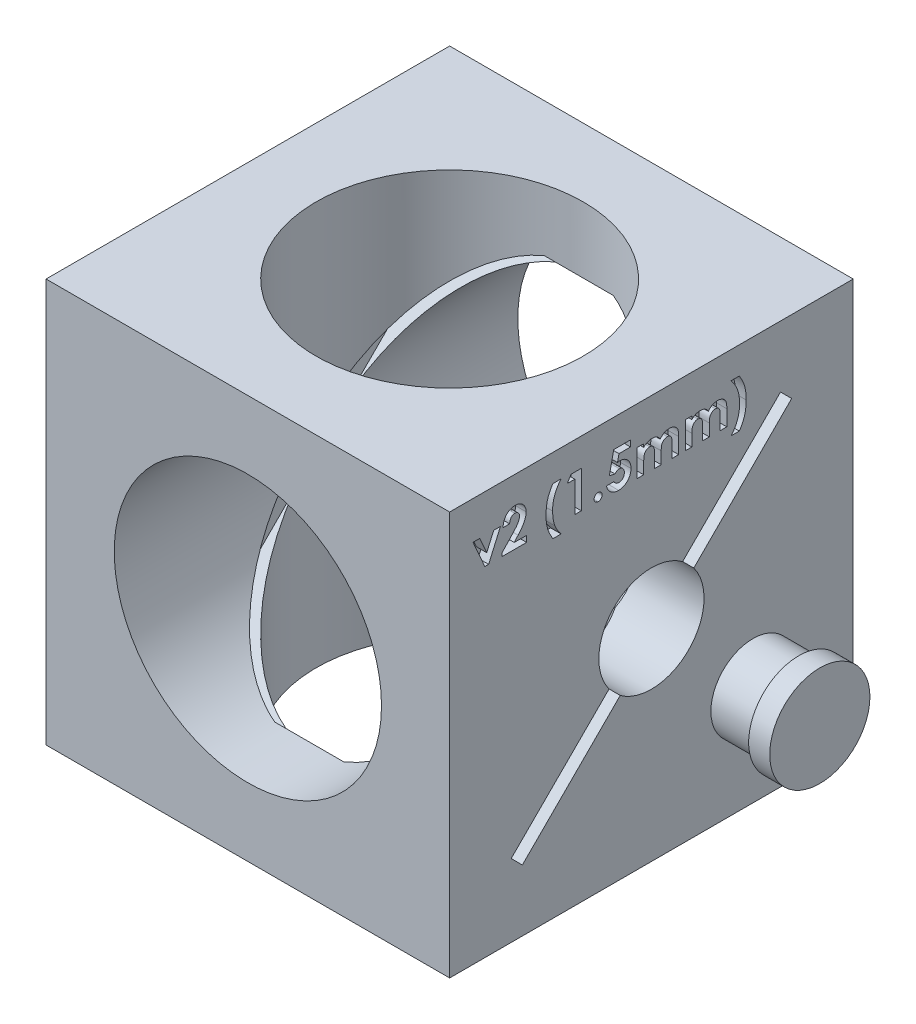
from build123d import *

# Parameters (mm, degrees)
SKETCH1_W               = 38.354
SKETCH1_H               = 38.354
BOSS_EXTRUDE1_DEPTH     = 19.177
CUT_EXTRUDE1_DEPTH      = 34.215538337
CUT_EXTRUDE1_DEPTH_BACK = 34.215538337
SKETCH2_R               = 12.7
CUT_EXTRUDE3_DEPTH      = 47.973864797
CUT_EXTRUDE3_DEPTH_BACK = 47.973864797
SKETCH3_R               = 12.7
CUT_EXTRUDE4_DEPTH      = 12.5
CUT_EXTRUDE5_DEPTH      = 34.215538337
SKETCH5_R               = 5
CUT_EXTRUDE6_DEPTH      = 10
CUT_EXTRUDE7_DEPTH      = 1
SKETCH7_R               = 4
BOSS_EXTRUDE2_DEPTH     = 6.35
SKETCH8_R               = 4.7625
BOSS_EXTRUDE3_DEPTH     = 2


with BuildPart() as part:
    # Sketch1 → Boss-Extrude1 (new, symmetric)
    with BuildSketch(Plane(origin=(0, 0, 0), x_dir=(1, 0, 0), z_dir=(0, 1, 0))):
        Rectangle(SKETCH1_W, SKETCH1_H)
    extrude(amount=BOSS_EXTRUDE1_DEPTH, both=True)

    # Sketch2 → Cut-Extrude1 (cut, two sides: drawn at the far end of the back side and taken through both)
    with BuildSketch(Plane.XY.offset(-CUT_EXTRUDE1_DEPTH_BACK)):
        Circle(SKETCH2_R)
    extrude(amount=CUT_EXTRUDE1_DEPTH + CUT_EXTRUDE1_DEPTH_BACK, mode=Mode.SUBTRACT)

    # Sketch3 → Cut-Extrude3 (cut, two sides: drawn at the far end of the back side and taken through both)
    with BuildSketch(Plane(origin=(0, 19.177, 0), x_dir=(0, 0, -1), z_dir=(0, -1, 0)).offset(-CUT_EXTRUDE3_DEPTH_BACK)):
        Circle(SKETCH3_R)
    extrude(amount=CUT_EXTRUDE3_DEPTH + CUT_EXTRUDE3_DEPTH_BACK, mode=Mode.SUBTRACT)

    # Sketch4 → Cut-Extrude4 (cut, symmetric)
    with BuildSketch(Plane(origin=(0, 0, 0), x_dir=(0, 0, -1), z_dir=(1, 0, 0))):
        Polygon((-12.268302654, -13.328962825), (13.328962825, 12.268302654), (12.268302654, 13.328962825), (-13.328962825, -12.268302654), align=None)
    extrude(amount=CUT_EXTRUDE4_DEPTH, both=True, mode=Mode.SUBTRACT)

    # Sketch4<2> → Cut-Extrude5 (cut, through all)
    with BuildSketch(Plane(origin=(0, 0, 0), x_dir=(0, 0, -1), z_dir=(1, 0, 0))):
        Polygon((-12.268302654, -13.328962825), (13.328962825, 12.268302654), (12.268302654, 13.328962825), (-13.328962825, -12.268302654), align=None)
    extrude(amount=CUT_EXTRUDE5_DEPTH, mode=Mode.SUBTRACT)

    # Sketch5 → Cut-Extrude6 (cut)
    with BuildSketch(Plane(origin=(19.177, 0, 0), x_dir=(0, 0, -1), z_dir=(1, 0, 0))):
        Circle(SKETCH5_R)
    extrude(amount=-CUT_EXTRUDE6_DEPTH, mode=Mode.SUBTRACT)

    # Sketch6 → Cut-Extrude7 (cut)
    with BuildSketch(Plane(origin=(19.177, 0, 0), x_dir=(0, 0, -1), z_dir=(1, 0, 0))):
        Polygon((-16.953526918, 15.574086484), (-16.314103841, 15.574086484), (-15.652244867, 14.064571259), (-14.990385892, 15.574086484), (-14.350962815, 15.574086484), (-15.471355444, 13.016394176), (-15.83313429, 13.016394176), align=None)
        with BuildLine():
            Line((-13.475962815, 15.349727509), (-14.104167944, 15.349727509))
            add(Edge.make_bspline(
                [(-14.104167944, 15.349727509), (-14.101454822, 15.397247904), (-14.096153545, 15.490099901), (-14.075066406, 15.624970401), (-14.046810364, 15.752408193), (-14.009098924, 15.871967484), (-13.961712033, 15.983604832), (-13.905869076, 16.087700814), (-13.840143394, 16.183707362), (-13.765933845, 16.271161479), (-13.684500303, 16.349617375), (-13.597533409, 16.419181301), (-13.503702885, 16.476583701), (-13.404723094, 16.523820563), (-13.300610889, 16.56156062), (-13.190381205, 16.586792903), (-13.07498847, 16.603880451), (-12.995992799, 16.60537568), (-12.955730444, 16.606137766)],
                knots=[0, 0, 0, 0, 1.199038563, 2.342849363, 3.436047546, 4.486744587, 5.497670872, 6.488682221, 7.459191391, 8.424610317, 9.374430501, 10.305433194, 11.225809216, 12.140057399, 13.06607119, 14.010487599, 14.985989317, 16, 16, 16, 16], degree=3))
            add(Edge.make_bspline(
                [(-12.955730444, 16.606137766), (-12.906308974, 16.604595686), (-12.809826684, 16.601585184), (-12.669630263, 16.575904604), (-12.538702135, 16.532949867), (-12.417137471, 16.47293077), (-12.305971174, 16.396682799), (-12.205221677, 16.305769572), (-12.117935806, 16.198283683), (-12.043560143, 16.078697443), (-11.981762857, 15.952072446), (-11.938457892, 15.821136948), (-11.909994005, 15.689365446), (-11.906958155, 15.600637187), (-11.905449995, 15.556558439)],
                knots=[0, 0, 0, 0, 1.075374347, 2.099382735, 3.09057751, 4.06680945, 5.040638231, 6.016817125, 7.011024321, 8.044445721, 9.0776792, 10.070479129, 11.0414456, 12, 12, 12, 12], degree=3))
            add(Edge.make_bspline(
                [(-11.905449995, 15.556558439), (-11.906037193, 15.529896497), (-11.907219078, 15.476232594), (-11.915436878, 15.395025937), (-11.927765203, 15.312307463), (-11.946353313, 15.228148095), (-11.96953421, 15.142524241), (-11.997655988, 15.05517966), (-12.03137096, 14.966609562), (-12.070116491, 14.875817107), (-12.116340008, 14.782507527), (-12.170160869, 14.685282075), (-12.233007601, 14.584226997), (-12.304121094, 14.478771705), (-12.383846731, 14.369082516), (-12.472573705, 14.255489849), (-12.569280089, 14.137593441), (-12.637915331, 14.058786308), (-12.67317836, 14.018297221)],
                knots=[0, 0, 0, 0, 0.728284026, 1.46585585, 2.227944881, 3.01186502, 3.81876927, 4.650621989, 5.517437689, 6.406905708, 7.346299482, 8.360816762, 9.441613733, 10.596154504, 11.834900912, 13.145207542, 14.533280747, 16, 16, 16, 16], degree=3))
            Line((-12.67317836, 14.018297221), (-13.038462815, 13.599727509))
            Line((-13.038462815, 13.599727509), (-11.8605782, 13.599727509))
            Line((-11.8605782, 13.599727509), (-11.8605782, 13.016394176))
            Line((-11.8605782, 13.016394176), (-14.193911533, 13.016394176))
            Line((-14.193911533, 13.016394176), (-14.193911533, 13.334703471))
            Line((-14.193911533, 13.334703471), (-13.157653521, 14.437568054))
            add(Edge.make_bspline(
                [(-13.157653521, 14.437568054), (-13.127651188, 14.469738957), (-13.069545568, 14.532044454), (-12.986867258, 14.623546706), (-12.91205069, 14.710380158), (-12.846647249, 14.793469413), (-12.787224643, 14.870119392), (-12.736432524, 14.942640423), (-12.693806183, 15.010376888), (-12.647529244, 15.092055235), (-12.603581364, 15.189471198), (-12.563256525, 15.301698382), (-12.538675744, 15.408961723), (-12.535282819, 15.478856822), (-12.533655123, 15.512387766)],
                knots=[0, 0, 0, 0, 1.246127091, 2.413378631, 3.493388633, 4.492180848, 5.408488754, 6.240484944, 6.999099869, 7.674939598, 8.898438119, 10.020720584, 11.050475521, 12, 12, 12, 12], degree=3))
            add(Edge.make_bspline(
                [(-12.533655123, 15.512387766), (-12.534872112, 15.544826367), (-12.537230224, 15.607681358), (-12.563143957, 15.697092249), (-12.603290411, 15.778044682), (-12.659862435, 15.84811971), (-12.728388875, 15.905705007), (-12.807577612, 15.948535332), (-12.896783027, 15.973248234), (-12.959317723, 15.976341407), (-12.991487655, 15.977932638)],
                knots=[0, 0, 0, 0, 1.062038974, 2.057870785, 3.028805853, 4.01125022, 4.991535629, 5.949134679, 6.94496649, 8, 8, 8, 8], degree=3))
            add(Edge.make_bspline(
                [(-12.991487655, 15.977932638), (-13.008107052, 15.977344818), (-13.040825004, 15.9761876), (-13.088917836, 15.968484315), (-13.134681621, 15.954908079), (-13.178625735, 15.936717834), (-13.220281195, 15.912606534), (-13.259542933, 15.882885514), (-13.296824621, 15.848310055), (-13.33195527, 15.808988268), (-13.363928746, 15.765105143), (-13.392327471, 15.717061461), (-13.415808489, 15.664887046), (-13.436482031, 15.609270678), (-13.452426456, 15.549614993), (-13.464035975, 15.486277024), (-13.472861917, 15.419359812), (-13.474910379, 15.373360522), (-13.475962815, 15.349727509)],
                knots=[0, 0, 0, 0, 0.903469896, 1.778625579, 2.63899355, 3.493148037, 4.358286772, 5.247621495, 6.164656832, 7.118446693, 8.109501108, 9.111810964, 10.146451449, 11.215617525, 12.33435995, 13.498009769, 14.714554818, 16, 16, 16, 16], degree=3))
        make_face()
        with BuildLine():
            Line((-9.369492463, 16.606137766), (-8.584937174, 16.606137766))
            add(Edge.make_bspline(
                [(-8.584937174, 16.606137766), (-8.618302729, 16.567446187), (-8.684552619, 16.490621063), (-8.775970004, 16.370229089), (-8.861947043, 16.248153696), (-8.941254244, 16.123203094), (-9.014041285, 15.99559168), (-9.080909086, 15.865952964), (-9.140567383, 15.733637064), (-9.194056936, 15.598691844), (-9.241277206, 15.459989793), (-9.281902738, 15.316754706), (-9.316128169, 15.168848462), (-9.344272337, 15.016094259), (-9.365889837, 14.858629782), (-9.380960395, 14.696038351), (-9.391447276, 14.528851582), (-9.392232376, 14.415616166), (-9.392629482, 14.358341291)],
                knots=[0, 0, 0, 0, 1.00236213, 1.990267575, 2.964862165, 3.931797803, 4.893137898, 5.846900052, 6.793123604, 7.740135921, 8.694427184, 9.667077551, 10.660503013, 11.672460941, 12.714089686, 13.778281025, 14.87624668, 16, 16, 16, 16], degree=3))
            add(Edge.make_bspline(
                [(-9.392629482, 14.358341291), (-9.391969655, 14.296394575), (-9.390668945, 14.1742797), (-9.379974237, 13.993922463), (-9.362285246, 13.819255753), (-9.339052141, 13.649946068), (-9.307112875, 13.486779984), (-9.269512627, 13.328897075), (-9.224221447, 13.176997753), (-9.188168455, 13.078856122), (-9.170373873, 13.030416612)],
                knots=[0, 0, 0, 0, 1.097990858, 2.164457195, 3.201156713, 4.209415668, 5.192484095, 6.147015238, 7.085427113, 8, 8, 8, 8], degree=3))
            add(Edge.make_bspline(
                [(-9.170373873, 13.030416612), (-9.155112042, 12.99308202), (-9.123946202, 12.916841891), (-9.068506696, 12.803207669), (-9.006451304, 12.687105512), (-8.936135902, 12.569057194), (-8.860528079, 12.44753497), (-8.774766143, 12.325209563), (-8.683382293, 12.199538533), (-8.618156848, 12.116419472), (-8.584937174, 12.074086484)],
                knots=[0, 0, 0, 0, 0.860028042, 1.756243877, 2.695094802, 3.667075869, 4.686284936, 5.746781471, 6.852423585, 8, 8, 8, 8], degree=3))
            Line((-8.584937174, 12.074086484), (-9.369492463, 12.074086484))
            add(Edge.make_bspline(
                [(-9.369492463, 12.074086484), (-9.399069033, 12.122485947), (-9.457127885, 12.217494164), (-9.536681507, 12.361437656), (-9.611514255, 12.501572382), (-9.677878243, 12.640365828), (-9.738880377, 12.775990202), (-9.790705441, 12.910350495), (-9.838626324, 13.041213389), (-9.878097923, 13.171952532), (-9.911817129, 13.304203496), (-9.941649092, 13.440678092), (-9.965698957, 13.58300607), (-9.986287598, 13.730965312), (-10.001384345, 13.884661213), (-10.012497574, 14.043877158), (-10.019864695, 14.208699242), (-10.020507806, 14.320472666), (-10.02083461, 14.37727158)],
                knots=[0, 0, 0, 0, 1.119871376, 2.19830916, 3.246961562, 4.256259542, 5.235550337, 6.182491613, 7.09917337, 7.986748165, 8.877687696, 9.793695483, 10.744317876, 11.727190303, 12.742913882, 13.793068013, 14.878522868, 16, 16, 16, 16], degree=3))
            add(Edge.make_bspline(
                [(-10.02083461, 14.37727158), (-10.020567837, 14.432904328), (-10.020041864, 14.542590459), (-10.01178599, 14.704370757), (-9.999911149, 14.861004379), (-9.984401766, 15.012442368), (-9.962121329, 15.158469068), (-9.936652557, 15.299389656), (-9.905672825, 15.435047069), (-9.869741955, 15.566545011), (-9.827908024, 15.695525622), (-9.780893886, 15.824247262), (-9.727512765, 15.953342095), (-9.66768075, 16.082931533), (-9.602521827, 16.213572394), (-9.531041605, 16.344580813), (-9.453040758, 16.475786442), (-9.397553545, 16.562357109), (-9.369492463, 16.606137766)],
                knots=[0, 0, 0, 0, 1.13127193, 2.230428031, 3.293392423, 4.325815098, 5.325330466, 6.296707414, 7.23754678, 8.15420938, 9.068070667, 9.994306547, 10.940496973, 11.908145907, 12.896524899, 13.908929949, 14.942500703, 16, 16, 16, 16], degree=3))
        make_face()
        Polygon((-7.626503681, 16.516394176), (-6.655449995, 16.516394176), (-6.655449995, 13.016394176), (-7.283655123, 13.016394176), (-7.283655123, 15.933060843), (-8.001603841, 15.933060843), align=None)
        with BuildLine():
            add(Edge.make_bspline(
                [(-5.062501277, 13.734342894), (-5.037141381, 13.732952472), (-4.987212125, 13.730214971), (-4.915071158, 13.709785286), (-4.84996352, 13.673080447), (-4.791748593, 13.625205347), (-4.742523516, 13.567605208), (-4.706944744, 13.501919293), (-4.68478895, 13.430056296), (-4.682342934, 13.379969956), (-4.681091021, 13.354334881)],
                knots=[0, 0, 0, 0, 1.016957001, 2.002212695, 2.9757545, 3.99499976, 5.013036768, 5.994806404, 6.97370641, 8, 8, 8, 8], degree=3))
            add(Edge.make_bspline(
                [(-4.681091021, 13.354334881), (-4.682334733, 13.328695689), (-4.684764725, 13.278601305), (-4.70709806, 13.206598277), (-4.74247035, 13.140372484), (-4.791752542, 13.082155123), (-4.849722432, 13.033377771), (-4.915220852, 12.997011404), (-4.987074698, 12.975422796), (-5.037117192, 12.972835028), (-5.062501277, 12.971522381)],
                knots=[0, 0, 0, 0, 1.023218912, 1.999186227, 2.986238111, 4.008388923, 5.030539734, 6.0011649, 6.986089706, 8, 8, 8, 8], degree=3))
            add(Edge.make_bspline(
                [(-5.062501277, 12.971522381), (-5.087891377, 12.972824354), (-5.137945728, 12.975391079), (-5.209911266, 12.997193375), (-5.275893246, 13.033134975), (-5.333877701, 13.08221429), (-5.383380064, 13.140166332), (-5.417746688, 13.206807232), (-5.440288051, 13.278574159), (-5.442684823, 13.328686499), (-5.443911533, 13.354334881)],
                knots=[0, 0, 0, 0, 1.013427518, 1.99788335, 2.976245624, 3.997909735, 5.019573847, 6.001765691, 6.977268297, 8, 8, 8, 8], degree=3))
            add(Edge.make_bspline(
                [(-5.443911533, 13.354334881), (-5.44267673, 13.379979307), (-5.440264146, 13.430083914), (-5.417899567, 13.501707932), (-5.383324986, 13.567812481), (-5.333881829, 13.625146057), (-5.275650916, 13.673321348), (-5.2100618, 13.709605809), (-5.13780837, 13.730246922), (-5.087867217, 13.732963234), (-5.062501277, 13.734342894)],
                knots=[0, 0, 0, 0, 1.025808215, 2.00424526, 2.981110158, 3.998665696, 5.017428914, 5.998734231, 6.983523959, 8, 8, 8, 8], degree=3))
        make_face()
        with BuildLine():
            Line((-3.582433168, 16.516394176), (-1.988783328, 16.516394176))
            Line((-1.988783328, 16.516394176), (-1.988783328, 15.933060843))
            Line((-1.988783328, 15.933060843), (-3.084636694, 15.933060843))
            Line((-3.084636694, 15.933060843), (-3.221355444, 15.271201868))
            add(Edge.make_bspline(
                [(-3.221355444, 15.271201868), (-3.202725557, 15.276390527), (-3.165983592, 15.286623628), (-3.110631777, 15.296886133), (-3.056988155, 15.303537963), (-3.021787537, 15.304425229), (-3.004708809, 15.304855714)],
                knots=[0, 0, 0, 0, 1.05461699, 2.079921384, 3.068411212, 4, 4, 4, 4], degree=3))
            add(Edge.make_bspline(
                [(-3.004708809, 15.304855714), (-2.967492471, 15.304002924), (-2.894130871, 15.302321885), (-2.786812159, 15.286363346), (-2.684048152, 15.26122913), (-2.586153321, 15.225382554), (-2.493223294, 15.178727308), (-2.405145422, 15.122287539), (-2.321811605, 15.055964118), (-2.244702202, 14.979715521), (-2.173850861, 14.895992835), (-2.112249661, 14.805437892), (-2.059638392, 14.709341916), (-2.017793208, 14.607107577), (-1.984765421, 14.499376976), (-1.960898805, 14.386081076), (-1.946785282, 14.267085603), (-1.94488216, 14.1859035), (-1.943911533, 14.144499144)],
                knots=[0, 0, 0, 0, 1.01440847, 1.999622559, 2.951875003, 3.895578053, 4.836219714, 5.782137149, 6.743708247, 7.735272588, 8.734977101, 9.730283169, 10.717124674, 11.717316708, 12.737475749, 13.78628267, 14.87096371, 16, 16, 16, 16], degree=3))
            add(Edge.make_bspline(
                [(-1.943911533, 14.144499144), (-1.945097655, 14.102624753), (-1.94743822, 14.019994338), (-1.962708262, 13.8984984), (-1.98966016, 13.78213272), (-2.026681289, 13.670585789), (-2.075454256, 13.56467745), (-2.134110424, 13.463310573), (-2.203641511, 13.367237571), (-2.283365179, 13.277443309), (-2.370035263, 13.195369629), (-2.462318444, 13.123169257), (-2.559566403, 13.062413228), (-2.661781489, 13.013312085), (-2.768377259, 12.974464134), (-2.879386068, 12.946184681), (-2.995347404, 12.929967986), (-3.074070084, 12.927768538), (-3.114083809, 12.926650586)],
                knots=[0, 0, 0, 0, 1.06808661, 2.107647099, 3.116961351, 4.110378221, 5.100014249, 6.085620622, 7.093190682, 8.119403071, 9.144090782, 10.133780668, 11.103064255, 12.062861538, 13.020824475, 13.992378307, 14.979551724, 16, 16, 16, 16], degree=3))
            add(Edge.make_bspline(
                [(-3.114083809, 12.926650586), (-3.149866893, 12.92756514), (-3.220438622, 12.929368831), (-3.324387681, 12.940455269), (-3.424606117, 12.960056194), (-3.520561879, 12.988423808), (-3.613264584, 13.023337865), (-3.701642561, 13.067004492), (-3.786181462, 13.118592216), (-3.866641228, 13.177159562), (-3.941714504, 13.243133404), (-4.010233435, 13.315353143), (-4.072612844, 13.392908481), (-4.127517909, 13.476756218), (-4.174776519, 13.566772471), (-4.216686419, 13.66189638), (-4.250990092, 13.763121342), (-4.268398218, 13.833296109), (-4.277244867, 13.868958279)],
                knots=[0, 0, 0, 0, 1.054957082, 2.080596141, 3.077793124, 4.061112343, 5.027190972, 5.994718051, 6.962465889, 7.943658696, 8.924948258, 9.904494768, 10.875059, 11.855380583, 12.854004648, 13.869083016, 14.917087635, 16, 16, 16, 16], degree=3))
            Line((-4.277244867, 13.868958279), (-3.559296149, 13.868958279))
            add(Edge.make_bspline(
                [(-3.559296149, 13.868958279), (-3.546172029, 13.844245847), (-3.5206668, 13.796220057), (-3.472150215, 13.732458604), (-3.417838978, 13.678085577), (-3.358223007, 13.632569738), (-3.292916026, 13.598470046), (-3.224579173, 13.572610418), (-3.152353959, 13.557667096), (-3.103165399, 13.555799033), (-3.078326598, 13.554855714)],
                knots=[0, 0, 0, 0, 1.104910296, 2.147267069, 3.153527244, 4.136738762, 5.099945312, 6.05603338, 7.018353, 8, 8, 8, 8], degree=3))
            add(Edge.make_bspline(
                [(-3.078326598, 13.554855714), (-3.061014286, 13.555507084), (-3.026952021, 13.556788664), (-2.97676666, 13.563568545), (-2.928862527, 13.576409485), (-2.882883469, 13.594191202), (-2.838705972, 13.616367011), (-2.796963336, 13.644362526), (-2.756929316, 13.676586401), (-2.719213391, 13.713563407), (-2.685053634, 13.754784168), (-2.655099263, 13.799078685), (-2.628315925, 13.845462725), (-2.608477097, 13.895773677), (-2.592230775, 13.948509237), (-2.580266326, 14.004067206), (-2.573116218, 14.06251247), (-2.57245431, 14.102411414), (-2.572116662, 14.122764368)],
                knots=[0, 0, 0, 0, 0.978869489, 1.925942215, 2.855067702, 3.774946051, 4.70828698, 5.642468714, 6.60995405, 7.609372294, 8.622401667, 9.629904756, 10.629323, 11.642352373, 12.678539694, 13.745912462, 14.850161547, 16, 16, 16, 16], degree=3))
            add(Edge.make_bspline(
                [(-2.572116662, 14.122764368), (-2.572508541, 14.142644884), (-2.573271344, 14.181342791), (-2.579581403, 14.238165179), (-2.590869977, 14.292079342), (-2.606250755, 14.343498222), (-2.625939988, 14.392109578), (-2.650001546, 14.43820277), (-2.678538224, 14.481544812), (-2.711703228, 14.521253303), (-2.747070047, 14.55767506), (-2.785065376, 14.589529239), (-2.825346895, 14.615965996), (-2.866662907, 14.639046054), (-2.910662599, 14.655843217), (-2.956356593, 14.667410803), (-3.003696837, 14.675898633), (-3.03598659, 14.676397324), (-3.052385091, 14.676650586)],
                knots=[0, 0, 0, 0, 1.166249705, 2.270133367, 3.348514167, 4.393962215, 5.415026464, 6.420877785, 7.440098956, 8.453121383, 9.451844239, 10.415694839, 11.355045125, 12.27538808, 13.187007209, 14.108269027, 15.039275622, 16, 16, 16, 16], degree=3))
            add(Edge.make_bspline(
                [(-3.052385091, 14.676650586), (-3.070197675, 14.675974698), (-3.105897914, 14.674620072), (-3.158939534, 14.663597844), (-3.211341619, 14.645759745), (-3.26339558, 14.62114926), (-3.31458469, 14.5889419), (-3.366259855, 14.55116636), (-3.416691396, 14.505077888), (-3.448757172, 14.470751089), (-3.465345828, 14.452992734)],
                knots=[0, 0, 0, 0, 0.88288272, 1.769486374, 2.674910571, 3.623812639, 4.617874466, 5.670434592, 6.794841017, 8, 8, 8, 8], degree=3))
            Line((-3.465345828, 14.452992734), (-3.993991662, 14.574286804))
            Line((-3.993991662, 14.574286804), (-3.582433168, 16.516394176))
        make_face()
        with BuildLine():
            Line((-1.3605782, 15.574086484), (-0.732373072, 15.574086484))
            Line((-0.732373072, 15.574086484), (-0.732373072, 15.268397381))
            add(Edge.make_bspline(
                [(-0.732373072, 15.268397381), (-0.704430827, 15.296599136), (-0.649414843, 15.352126074), (-0.558242596, 15.423510944), (-0.463140711, 15.484553827), (-0.362956702, 15.533971883), (-0.257935617, 15.571706137), (-0.148575201, 15.599357243), (-0.034313732, 15.615670529), (0.043482884, 15.617850214), (0.083031576, 15.618958279)],
                knots=[0, 0, 0, 0, 1.041528618, 2.050684245, 3.032913108, 4.004406485, 4.976926473, 5.95771665, 6.961784757, 8, 8, 8, 8], degree=3))
            add(Edge.make_bspline(
                [(0.083031576, 15.618958279), (0.122632485, 15.617712654), (0.200585594, 15.615260681), (0.314318638, 15.592822836), (0.422062525, 15.556368919), (0.522631821, 15.504408339), (0.61675338, 15.440239724), (0.700257556, 15.360547921), (0.775421349, 15.268505287), (0.815486544, 15.198920067), (0.836036383, 15.163229112)],
                knots=[0, 0, 0, 0, 1.023965777, 2.015643508, 2.987309376, 3.958410333, 4.93654923, 5.924956801, 6.93568961, 8, 8, 8, 8], degree=3))
            add(Edge.make_bspline(
                [(0.836036383, 15.163229112), (0.862507231, 15.19901716), (0.914462078, 15.269259055), (1.006556775, 15.360967813), (1.10613862, 15.440248034), (1.215134291, 15.504882077), (1.330649242, 15.55619156), (1.452177993, 15.592687389), (1.578618724, 15.615223181), (1.66466858, 15.617702903), (1.708231896, 15.618958279)],
                knots=[0, 0, 0, 0, 1.041189987, 2.043563759, 3.033412161, 4.015238574, 5.00275396, 5.986226558, 6.980513695, 8, 8, 8, 8], degree=3))
            add(Edge.make_bspline(
                [(1.708231896, 15.618958279), (1.753227629, 15.617654765), (1.840852636, 15.615116292), (1.967833853, 15.590142167), (2.086767129, 15.551553397), (2.195024072, 15.495397293), (2.292913441, 15.428878163), (2.376326992, 15.350283035), (2.445552617, 15.262354428), (2.490627377, 15.180250565), (2.519766998, 15.107661348), (2.53736176, 15.044495127), (2.553818306, 14.973962053), (2.565640688, 14.895114062), (2.576676359, 14.808692263), (2.583083001, 14.714122095), (2.587437661, 14.611722144), (2.587900181, 14.540872175), (2.588139749, 14.504174625)],
                knots=[0, 0, 0, 0, 1.321991808, 2.574456155, 3.791773975, 4.987670122, 6.148905103, 7.262530793, 8.344737981, 9.427709016, 10.004683293, 10.642050061, 11.354108788, 12.133887687, 12.985666279, 13.916212488, 14.92067847, 16, 16, 16, 16], degree=3))
            Line((2.588139749, 14.504174625), (2.588139749, 13.016394176))
            Line((2.588139749, 13.016394176), (1.95993462, 13.016394176))
            Line((1.95993462, 13.016394176), (1.95993462, 14.300849304))
            add(Edge.make_bspline(
                [(1.95993462, 14.300849304), (1.959411759, 14.335206091), (1.958408173, 14.40115084), (1.954141542, 14.495735991), (1.944590998, 14.581516561), (1.933396536, 14.658967693), (1.917377046, 14.727678734), (1.897844186, 14.787815319), (1.875186187, 14.839464014), (1.847827337, 14.882619434), (1.817185392, 14.918963115), (1.783100649, 14.950116846), (1.745928493, 14.976697144), (1.705331903, 14.999353071), (1.660247355, 15.014675723), (1.612196829, 15.026698422), (1.560804318, 15.034885966), (1.525271547, 15.035374084), (1.507009941, 15.035624945)],
                knots=[0, 0, 0, 0, 1.669139205, 3.203761885, 4.596586177, 5.860166715, 7.002923539, 8.018877315, 8.928339525, 9.734594377, 10.491888885, 11.231098709, 11.971440889, 12.708030942, 13.480072485, 14.275788656, 15.113863979, 16, 16, 16, 16], degree=3))
            add(Edge.make_bspline(
                [(1.507009941, 15.035624945), (1.478869065, 15.034652042), (1.423648195, 15.032742914), (1.343180133, 15.014499052), (1.267459094, 14.984672291), (1.196768759, 14.944095625), (1.132630229, 14.893416135), (1.076525251, 14.833305427), (1.030190363, 14.76341708), (0.998116225, 14.698574712), (0.978073917, 14.639944182), (0.963935891, 14.589731842), (0.952915861, 14.532949112), (0.944290404, 14.47017107), (0.936015286, 14.401042827), (0.931955559, 14.325651796), (0.927801219, 14.244102714), (0.9278553, 14.187741807), (0.927883338, 14.15852158)],
                knots=[0, 0, 0, 0, 1.129913425, 2.217230253, 3.297175357, 4.391411011, 5.481605898, 6.571841268, 7.681894157, 8.841607612, 9.468549532, 10.170608623, 10.93710061, 11.791434153, 12.717934886, 13.734733707, 14.825576123, 16, 16, 16, 16], degree=3))
            Line((0.927883338, 14.15852158), (0.927883338, 13.016394176))
            Line((0.927883338, 13.016394176), (0.29967821, 13.016394176))
            Line((0.29967821, 13.016394176), (0.29967821, 14.242656195))
            add(Edge.make_bspline(
                [(0.29967821, 14.242656195), (0.299625466, 14.270003453), (0.299524003, 14.322610718), (0.29647423, 14.398576616), (0.292435736, 14.468720705), (0.286774236, 14.533238629), (0.280244811, 14.592050145), (0.270821346, 14.644833511), (0.260921127, 14.691879582), (0.243947068, 14.745322513), (0.220028435, 14.804546226), (0.184293648, 14.867349675), (0.14108541, 14.919932762), (0.091495806, 14.962704697), (0.035457427, 14.995293479), (-0.025610103, 15.019535483), (-0.092872828, 15.032620573), (-0.139171991, 15.034602354), (-0.163062174, 15.035624945)],
                knots=[0, 0, 0, 0, 1.256487322, 2.417074606, 3.49288742, 4.484586665, 5.393016842, 6.210437544, 6.947749329, 7.599905853, 8.784490193, 9.876739139, 10.906602197, 11.896672079, 12.869113195, 13.872201355, 14.902064413, 16, 16, 16, 16], degree=3))
            add(Edge.make_bspline(
                [(-0.163062174, 15.035624945), (-0.190056026, 15.034708727), (-0.243517573, 15.03289415), (-0.321392485, 15.013404103), (-0.395848122, 14.984124607), (-0.465246537, 14.942416196), (-0.528418817, 14.890544063), (-0.583962065, 14.828723557), (-0.630053445, 14.757028008), (-0.662269954, 14.690397055), (-0.682020021, 14.630303775), (-0.696538199, 14.578787624), (-0.707148214, 14.520754411), (-0.716000632, 14.456855745), (-0.724226759, 14.387016202), (-0.728303283, 14.310928654), (-0.732453518, 14.228677439), (-0.732400534, 14.171849579), (-0.732373072, 14.142395779)],
                knots=[0, 0, 0, 0, 1.07893236, 2.136834559, 3.195274846, 4.273923004, 5.364443877, 6.458052972, 7.587287137, 8.767908, 9.410170275, 10.118584836, 10.909717261, 11.770069756, 12.702352573, 13.724628867, 14.820678298, 16, 16, 16, 16], degree=3))
            Line((-0.732373072, 14.142395779), (-0.732373072, 13.016394176))
            Line((-0.732373072, 13.016394176), (-1.3605782, 13.016394176))
            Line((-1.3605782, 13.016394176), (-1.3605782, 15.574086484))
        make_face()
        with BuildLine():
            Line((3.216344877, 15.574086484), (3.844550005, 15.574086484))
            Line((3.844550005, 15.574086484), (3.844550005, 15.268397381))
            add(Edge.make_bspline(
                [(3.844550005, 15.268397381), (3.87249225, 15.296599136), (3.927508234, 15.352126074), (4.018680481, 15.423510944), (4.113782366, 15.484553827), (4.213966375, 15.533971883), (4.318987459, 15.571706137), (4.428347876, 15.599357243), (4.542609344, 15.615670529), (4.620405961, 15.617850214), (4.659954652, 15.618958279)],
                knots=[0, 0, 0, 0, 1.041528618, 2.050684245, 3.032913108, 4.004406485, 4.976926473, 5.95771665, 6.961784757, 8, 8, 8, 8], degree=3))
            add(Edge.make_bspline(
                [(4.659954652, 15.618958279), (4.699555562, 15.617712654), (4.777508671, 15.615260681), (4.891241715, 15.592822836), (4.998985602, 15.556368919), (5.099554898, 15.504408339), (5.193676457, 15.440239724), (5.277180633, 15.360547921), (5.352344426, 15.268505287), (5.392409621, 15.198920067), (5.41295946, 15.163229112)],
                knots=[0, 0, 0, 0, 1.023965777, 2.015643508, 2.987309376, 3.958410333, 4.93654923, 5.924956801, 6.93568961, 8, 8, 8, 8], degree=3))
            add(Edge.make_bspline(
                [(5.41295946, 15.163229112), (5.439430308, 15.19901716), (5.491385155, 15.269259055), (5.583479852, 15.360967813), (5.683061697, 15.440248034), (5.792057368, 15.504882077), (5.907572319, 15.55619156), (6.02910107, 15.592687389), (6.1555418, 15.615223181), (6.241591657, 15.617702903), (6.285154973, 15.618958279)],
                knots=[0, 0, 0, 0, 1.041189987, 2.043563759, 3.033412161, 4.015238574, 5.00275396, 5.986226558, 6.980513695, 8, 8, 8, 8], degree=3))
            add(Edge.make_bspline(
                [(6.285154973, 15.618958279), (6.330150706, 15.617654765), (6.417775712, 15.615116292), (6.54475693, 15.590142167), (6.663690206, 15.551553397), (6.771947149, 15.495397293), (6.869836518, 15.428878163), (6.953250068, 15.350283035), (7.022475694, 15.262354428), (7.067550453, 15.180250565), (7.096690075, 15.107661348), (7.114284837, 15.044495127), (7.130741383, 14.973962053), (7.142563764, 14.895114062), (7.153599436, 14.808692263), (7.160006077, 14.714122095), (7.164360738, 14.611722144), (7.164823258, 14.540872175), (7.165062826, 14.504174625)],
                knots=[0, 0, 0, 0, 1.321991808, 2.574456155, 3.791773975, 4.987670122, 6.148905103, 7.262530793, 8.344737981, 9.427709016, 10.004683293, 10.642050061, 11.354108788, 12.133887687, 12.985666279, 13.916212488, 14.92067847, 16, 16, 16, 16], degree=3))
            Line((7.165062826, 14.504174625), (7.165062826, 13.016394176))
            Line((7.165062826, 13.016394176), (6.536857697, 13.016394176))
            Line((6.536857697, 13.016394176), (6.536857697, 14.300849304))
            add(Edge.make_bspline(
                [(6.536857697, 14.300849304), (6.536334836, 14.335206091), (6.53533125, 14.40115084), (6.531064619, 14.495735991), (6.521514075, 14.581516561), (6.510319613, 14.658967693), (6.494300123, 14.727678734), (6.474767263, 14.787815319), (6.452109264, 14.839464014), (6.424750414, 14.882619434), (6.394108469, 14.918963115), (6.360023726, 14.950116846), (6.32285157, 14.976697144), (6.28225498, 14.999353071), (6.237170432, 15.014675723), (6.189119906, 15.026698422), (6.137727395, 15.034885966), (6.102194624, 15.035374084), (6.083933018, 15.035624945)],
                knots=[0, 0, 0, 0, 1.669139205, 3.203761885, 4.596586177, 5.860166715, 7.002923539, 8.018877315, 8.928339525, 9.734594377, 10.491888885, 11.231098709, 11.971440889, 12.708030942, 13.480072485, 14.275788656, 15.113863979, 16, 16, 16, 16], degree=3))
            add(Edge.make_bspline(
                [(6.083933018, 15.035624945), (6.055792142, 15.034652042), (6.000571272, 15.032742914), (5.92010321, 15.014499052), (5.844382171, 14.984672291), (5.773691836, 14.944095625), (5.709553306, 14.893416135), (5.653448328, 14.833305427), (5.60711344, 14.76341708), (5.575039302, 14.698574712), (5.554996994, 14.639944182), (5.540858968, 14.589731842), (5.529838938, 14.532949112), (5.521213481, 14.47017107), (5.512938363, 14.401042827), (5.508878636, 14.325651796), (5.504724296, 14.244102714), (5.504778377, 14.187741807), (5.504806415, 14.15852158)],
                knots=[0, 0, 0, 0, 1.129913425, 2.217230253, 3.297175357, 4.391411011, 5.481605898, 6.571841268, 7.681894157, 8.841607612, 9.468549532, 10.170608623, 10.93710061, 11.791434153, 12.717934886, 13.734733707, 14.825576123, 16, 16, 16, 16], degree=3))
            Line((5.504806415, 14.15852158), (5.504806415, 13.016394176))
            Line((5.504806415, 13.016394176), (4.876601287, 13.016394176))
            Line((4.876601287, 13.016394176), (4.876601287, 14.242656195))
            add(Edge.make_bspline(
                [(4.876601287, 14.242656195), (4.876548543, 14.270003453), (4.87644708, 14.322610718), (4.873397307, 14.398576616), (4.869358812, 14.468720705), (4.863697313, 14.533238629), (4.857167888, 14.592050145), (4.847744423, 14.644833511), (4.837844204, 14.691879582), (4.820870144, 14.745322513), (4.796951512, 14.804546226), (4.761216725, 14.867349675), (4.718008487, 14.919932762), (4.668418883, 14.962704697), (4.612380504, 14.995293479), (4.551312974, 15.019535483), (4.484050249, 15.032620573), (4.437751085, 15.034602354), (4.413860902, 15.035624945)],
                knots=[0, 0, 0, 0, 1.256487322, 2.417074606, 3.49288742, 4.484586665, 5.393016842, 6.210437544, 6.947749329, 7.599905853, 8.784490193, 9.876739139, 10.906602197, 11.896672079, 12.869113195, 13.872201355, 14.902064413, 16, 16, 16, 16], degree=3))
            add(Edge.make_bspline(
                [(4.413860902, 15.035624945), (4.386867051, 15.034708727), (4.333405504, 15.03289415), (4.255530592, 15.013404103), (4.181074955, 14.984124607), (4.11167654, 14.942416196), (4.04850426, 14.890544063), (3.992961012, 14.828723557), (3.946869632, 14.757028008), (3.914653122, 14.690397055), (3.894903056, 14.630303775), (3.880384878, 14.578787624), (3.869774863, 14.520754411), (3.860922445, 14.456855745), (3.852696318, 14.387016202), (3.848619794, 14.310928654), (3.844469559, 14.228677439), (3.844522543, 14.171849579), (3.844550005, 14.142395779)],
                knots=[0, 0, 0, 0, 1.07893236, 2.136834559, 3.195274846, 4.273923004, 5.364443877, 6.458052972, 7.587287137, 8.767908, 9.410170275, 10.118584836, 10.909717261, 11.770069756, 12.702352573, 13.724628867, 14.820678298, 16, 16, 16, 16], degree=3))
            Line((3.844550005, 14.142395779), (3.844550005, 13.016394176))
            Line((3.844550005, 13.016394176), (3.216344877, 13.016394176))
            Line((3.216344877, 13.016394176), (3.216344877, 15.574086484))
        make_face()
        with BuildLine():
            Line((8.353464268, 12.074086484), (7.568908979, 12.074086484))
            add(Edge.make_bspline(
                [(7.568908979, 12.074086484), (7.60227626, 12.112777092), (7.668529577, 12.189600288), (7.759921657, 12.310006495), (7.845993068, 12.432028807), (7.924735601, 12.556832482), (7.998569897, 12.683266866), (8.063986403, 12.813093629), (8.123732085, 12.944984297), (8.17747439, 13.079607518), (8.224514335, 13.218140912), (8.265230618, 13.3613545), (8.299259601, 13.509575858), (8.328406338, 13.662419905), (8.349856861, 13.82043153), (8.364906218, 13.983252106), (8.375436262, 14.150905008), (8.376209429, 14.264374292), (8.376601287, 14.321882958)],
                knots=[0, 0, 0, 0, 1.002349761, 1.990243017, 2.964825581, 3.931749288, 4.885124716, 5.836788903, 6.783000779, 7.725738754, 8.680018241, 9.652656607, 10.646069811, 11.663363356, 12.704979249, 13.773722967, 14.871675074, 16, 16, 16, 16], degree=3))
            add(Edge.make_bspline(
                [(8.376601287, 14.321882958), (8.375942356, 14.383829787), (8.374643411, 14.505944885), (8.363935871, 14.686300503), (8.34631687, 14.860742835), (8.32296032, 15.029803457), (8.291050536, 15.192731637), (8.253736571, 15.350235329), (8.207918983, 15.501507367), (8.172100522, 15.599252841), (8.154345678, 15.647704272)],
                knots=[0, 0, 0, 0, 1.099645224, 2.167718429, 3.205979964, 4.211650066, 5.196199703, 6.152169059, 7.084049107, 8, 8, 8, 8], degree=3))
            add(Edge.make_bspline(
                [(8.154345678, 15.647704272), (8.139081605, 15.685037532), (8.107911186, 15.76127494), (8.052507702, 15.874930565), (7.990210983, 15.991123539), (7.920361516, 16.109683462), (7.844242832, 16.231346311), (7.759006781, 16.354266141), (7.667121282, 16.480041584), (7.602087039, 16.563539981), (7.568908979, 16.606137766)],
                knots=[0, 0, 0, 0, 0.858702877, 1.753537788, 2.690942094, 3.665716508, 4.683355137, 5.746314987, 6.850253485, 8, 8, 8, 8], degree=3))
            Line((7.568908979, 16.606137766), (8.353464268, 16.606137766))
            add(Edge.make_bspline(
                [(8.353464268, 16.606137766), (8.38301464, 16.55772499), (8.441022064, 16.46269064), (8.520894263, 16.319030813), (8.594381881, 16.17822011), (8.662329292, 16.040291917), (8.721632046, 15.903822964), (8.775294051, 15.770049184), (8.821510774, 15.638316559), (8.861310603, 15.507801902), (8.895351398, 15.37560823), (8.924492237, 15.239192327), (8.950023398, 15.097088004), (8.970167354, 14.949242616), (8.985382061, 14.795567631), (8.996462117, 14.636345804), (9.003838412, 14.471525346), (9.004480255, 14.359751697), (9.004806415, 14.30295267)],
                knots=[0, 0, 0, 0, 1.119955126, 2.198473562, 3.245059523, 4.256446178, 5.233948972, 6.182657628, 7.102214905, 7.989856078, 8.87639277, 9.796980209, 10.743924827, 11.726870758, 12.742670299, 13.792902966, 14.878438998, 16, 16, 16, 16], degree=3))
            add(Edge.make_bspline(
                [(9.004806415, 14.30295267), (9.004539928, 14.24731988), (9.004014517, 14.137633668), (8.995754557, 13.975853961), (8.983894519, 13.819218198), (8.968308648, 13.667557828), (8.946165727, 13.521277345), (8.92062377, 13.380132055), (8.889618259, 13.244485333), (8.853875201, 13.113158053), (8.811567974, 12.984340134), (8.765093708, 12.855422577), (8.71141481, 12.726553077), (8.652497761, 12.596762576), (8.586296363, 12.466866658), (8.515081538, 12.335609686), (8.43699492, 12.204446547), (8.381519424, 12.117870076), (8.353464268, 12.074086484)],
                knots=[0, 0, 0, 0, 1.131238154, 2.230361439, 3.293294094, 4.325685945, 5.329872518, 6.301220463, 7.242031739, 8.158666971, 9.067978702, 9.998651369, 10.944813546, 11.906133471, 12.896617558, 13.90899238, 14.942532276, 16, 16, 16, 16], degree=3))
        make_face()
    extrude(amount=-CUT_EXTRUDE7_DEPTH, mode=Mode.SUBTRACT)

    # Sketch7 → Boss-Extrude2 (add)
    with BuildSketch(Plane(origin=(19.177, 0, 0), x_dir=(0, 0, -1), z_dir=(1, 0, 0))):
        with Locations((9.652, -9.652)):
            Circle(SKETCH7_R)
    extrude(amount=BOSS_EXTRUDE2_DEPTH)

    # Sketch8 → Boss-Extrude3 (add)
    with BuildSketch(Plane(origin=(25.527, 0, 0), x_dir=(0, 0, -1), z_dir=(1, 0, 0))):
        with Locations((9.652, -9.652)):
            Circle(SKETCH8_R)
    extrude(amount=-BOSS_EXTRUDE3_DEPTH)


solid = part.part
